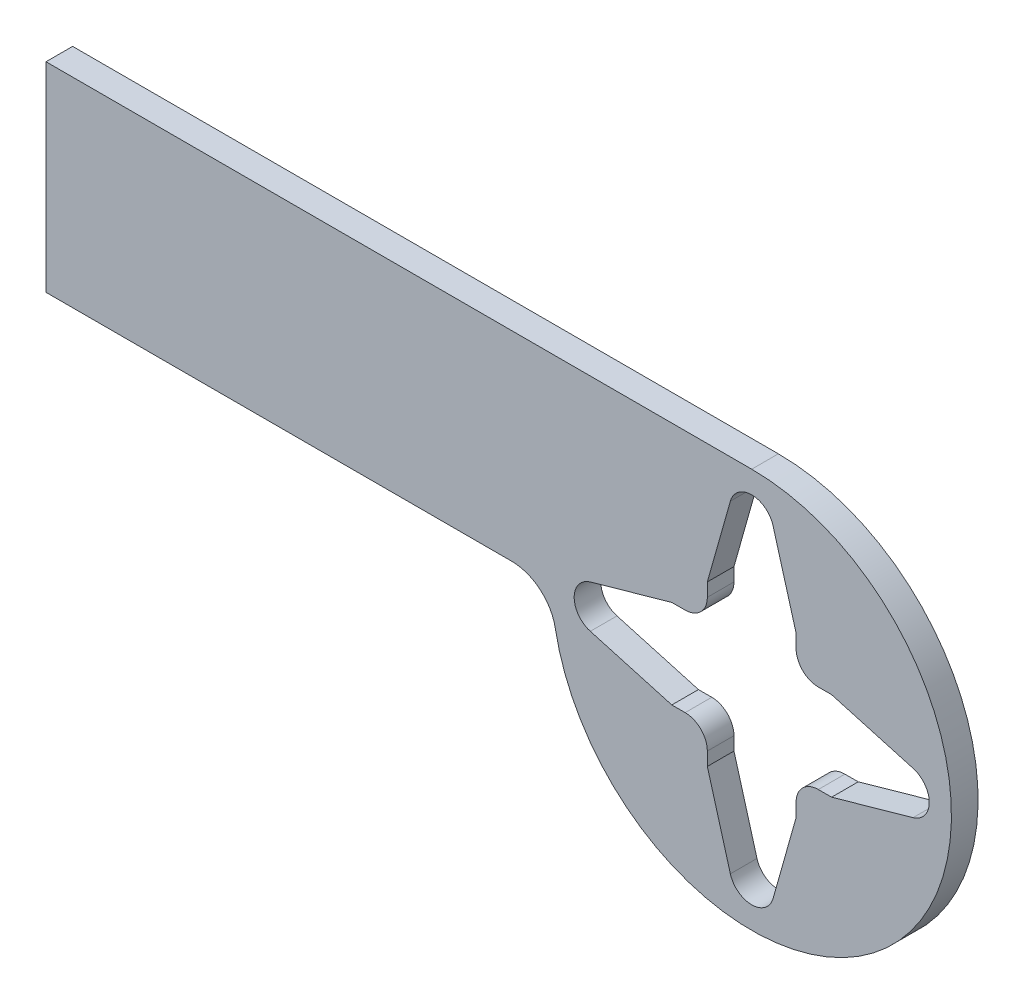
from build123d import *

# Parameters (mm, degrees)
SKETCH1_R           = 2.5
SKETCH1_W           = 57
SKETCH1_H           = 22.5
BOSS_EXTRUDE1_DEPTH = 3


with BuildPart() as part:
    # Sketch1 → Boss-Extrude1 (new body)
    # profile 1 of 8: a face of its own
    with BuildSketch(Plane.XY):
        with BuildLine():
            ThreePointArc((22.5, 0), (15.909902577, 15.909902577), (0, 22.5))
            Line((0, 22.5), (-22.5, 0))
            Line((-22.5, 0), (-22.124973736, -4.090909091))
            ThreePointArc((-22.124973736, -4.090909091), (2.054031517, -22.406047276), (22.5, 0))
        make_face()
        with BuildLine():
            ThreePointArc((-7.5, 5), (-9.267766953, 9.267766953), (-5, 7.5))
            Line((-5, 7.5), (-5, 9))
            Line((-5, 9), (-2.405779746, 18.179870439))
            ThreePointArc((-2.405779746, 18.179870439), (0, 20), (2.405779746, 18.179870439))
            Line((2.405779746, 18.179870439), (5, 9))
            Line((5, 9), (5, 7.5))
            ThreePointArc((5, 7.5), (7.5, 10), (10, 7.5))
            ThreePointArc((10, 7.5), (9.267766953, 5.732233047), (7.5, 5))
            Line((7.5, 5), (9, 5))
            Line((9, 5), (18.179870439, 2.405779746))
            ThreePointArc((18.179870439, 2.405779746), (19.493699588, 1.508363998), (20, 0))
            ThreePointArc((20, 0), (19.493699588, -1.508363998), (18.179870439, -2.405779746))
            Line((18.179870439, -2.405779746), (9, -5))
            Line((9, -5), (7.5, -5))
            ThreePointArc((7.5, -5), (9.267766953, -5.732233047), (10, -7.5))
            ThreePointArc((10, -7.5), (7.5, -10), (5, -7.5))
            Line((5, -7.5), (5, -9))
            Line((5, -9), (2.405779746, -18.179870439))
            ThreePointArc((2.405779746, -18.179870439), (0, -20), (-2.405779746, -18.179870439))
            Line((-2.405779746, -18.179870439), (-5, -9))
            Line((-5, -9), (-5, -7.5))
            ThreePointArc((-5, -7.5), (-9.267766953, -9.267766953), (-7.5, -5))
            Line((-7.5, -5), (-9, -5))
            Line((-9, -5), (-18.179870439, -2.405779746))
            ThreePointArc((-18.179870439, -2.405779746), (-20, 0), (-18.179870439, 2.405779746))
            Line((-18.179870439, 2.405779746), (-9, 5))
            Line((-9, 5), (-7.5, 5))
        make_face(mode=Mode.SUBTRACT)
    # profile 2 of 8: a face of its own
    with BuildSketch(Plane.XY):
        with Locations((-7.5, 7.5)):
            Circle(SKETCH1_R)
    # profile 3 of 8: a face of its own
    with BuildSketch(Plane.XY):
        with Locations((7.5, 7.5)):
            Circle(SKETCH1_R)
    # profile 4 of 8: a face of its own
    with BuildSketch(Plane.XY):
        with Locations((7.5, -7.5)):
            Circle(SKETCH1_R)
    # profile 5 of 8: a face of its own
    with BuildSketch(Plane.XY):
        with Locations((-7.5, -7.5)):
            Circle(SKETCH1_R)
    # profile 6 of 8: a face of its own
    with BuildSketch(Plane.XY):
        Polygon((-22.5, 22.5), (0, 22.5), (-22.5, 0), align=None)
    # profile 7 of 8: a face of its own
    with BuildSketch(Plane.XY):
        with Locations((-51, 11.25)):
            Rectangle(SKETCH1_W, SKETCH1_H)
    # profile 8 of 8: a face of its own
    with BuildSketch(Plane.XY):
        with BuildLine():
            Line((-22.5, 0), (-22.124973736, -4.090909091))
            ThreePointArc((-22.124973736, -4.090909091), (-23.843623821, -1.156469426), (-27.041634566, 0))
            Line((-27.041634566, 0), (-22.5, 0))
        make_face()
    extrude(amount=BOSS_EXTRUDE1_DEPTH)


solid = part.part
